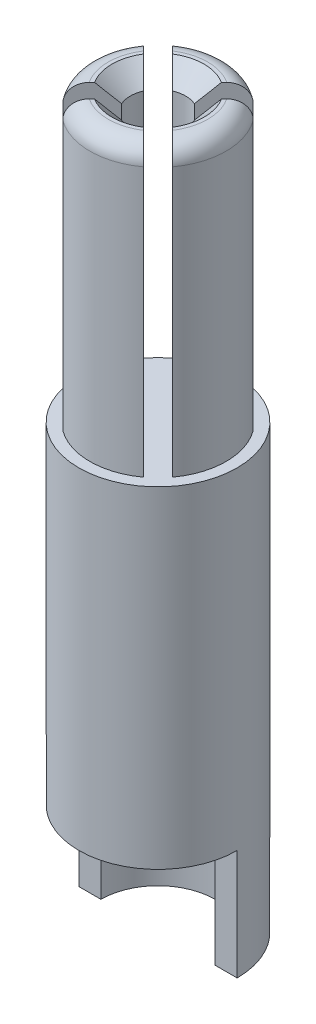
from build123d import *

# Parameters (mm, degrees)
CORTE_EXTRUS_O3_START = -7.8
ESBO_O2_R             = 2.15
CORTE_EXTRUS_O3_DEPTH = 7.8
ESBO_O3_W             = 4.788650246
ESBO_O3_H             = 2.452019704
CORTE_EXTRUS_O4_DEPTH = 3
CHANFRO1_SIZE         = 0.5
FILETE1_R             = 0.5


with BuildPart() as part:
    # Esboço1 → Revolução1 (revolve)
    with BuildSketch(Plane.XY, mode=Mode.PRIVATE) as revolu_o1_sk:
        Polygon((0, 10), (0, 19.8), (2.15, 19.8), (2.15, 0), (1.55, 0), (1.55, 7.5), align=None)
    revolve(revolu_o1_sk.sketch.rotate(Axis((0, 10, 0), (0, 1, 0)), 90), axis=Axis((0, 10, 0), (0, 1, 0)))

    # Esboço2 → Corte-extrusão3 (cut)
    with BuildSketch(Plane(origin=(0, 19.8, 0), x_dir=(1, 0, 0), z_dir=(0, 1, 0)).offset(CORTE_EXTRUS_O3_START)):
        with Locations(Location((0, 0, 0), (0, 0, 90))):
            Circle(ESBO_O2_R)
        with BuildLine():
            Line((-1.099159758, 1.488068488), (-0.298939494, 0.687848224))
            ThreePointArc((-0.298939494, 0.687848224), (0, 0.75), (0.298939494, 0.687848224))
            Line((0.298939494, 0.687848224), (1.099159758, 1.488068488))
            ThreePointArc((1.099159758, 1.488068488), (0, 1.85), (-1.099159758, 1.488068488))
        make_face(mode=Mode.SUBTRACT)
        with BuildLine():
            Line((-1.488068488, 1.099159758), (-0.687848224, 0.298939494))
            ThreePointArc((-0.687848224, 0.298939494), (-0.75, 0), (-0.687848224, -0.298939494))
            Line((-0.687848224, -0.298939494), (-1.488068488, -1.099159758))
            ThreePointArc((-1.488068488, -1.099159758), (-1.85, 0), (-1.488068488, 1.099159758))
        make_face(mode=Mode.SUBTRACT)
        with BuildLine():
            Line((1.099159758, -1.488068488), (0.298939494, -0.687848224))
            ThreePointArc((0.298939494, -0.687848224), (0, -0.75), (-0.298939494, -0.687848224))
            Line((-0.298939494, -0.687848224), (-1.099159758, -1.488068488))
            ThreePointArc((-1.099159758, -1.488068488), (0, -1.85), (1.099159758, -1.488068488))
        make_face(mode=Mode.SUBTRACT)
        with BuildLine():
            Line((1.488068488, 1.099159758), (0.687848224, 0.298939494))
            ThreePointArc((0.687848224, 0.298939494), (0.75, 0), (0.687848224, -0.298939494))
            Line((0.687848224, -0.298939494), (1.488068488, -1.099159758))
            ThreePointArc((1.488068488, -1.099159758), (1.85, 0), (1.488068488, 1.099159758))
        make_face(mode=Mode.SUBTRACT)
    extrude(amount=CORTE_EXTRUS_O3_DEPTH, mode=Mode.SUBTRACT)

    # Esboço3 → Corte-extrusão4 (cut)
    with BuildSketch(Plane.XZ):
        with Locations((0, 1.226009852)):
            Rectangle(ESBO_O3_W, ESBO_O3_H)
    extrude(amount=-CORTE_EXTRUS_O4_DEPTH, mode=Mode.SUBTRACT)

    # Chanfro1
    chanfro1_edges = [part.edges().sort_by_distance(p)[0] for p in [
        (0, 19.8, -0.75),
        (-0.75, 19.8, 0),
        (0.75, 19.8, 0),
        (0, 19.8, 0.75),
    ]]
    chamfer(chanfro1_edges, length=CHANFRO1_SIZE)

    # Filete1
    filete1_edges = [part.edges().sort_by_distance(p)[0] for p in [
        (0, 19.8, -1.85),
        (-1.85, 19.8, 0),
        (1.85, 19.8, 0),
        (0, 19.8, 1.85),
    ]]
    fillet(filete1_edges, radius=FILETE1_R)


solid = part.part
